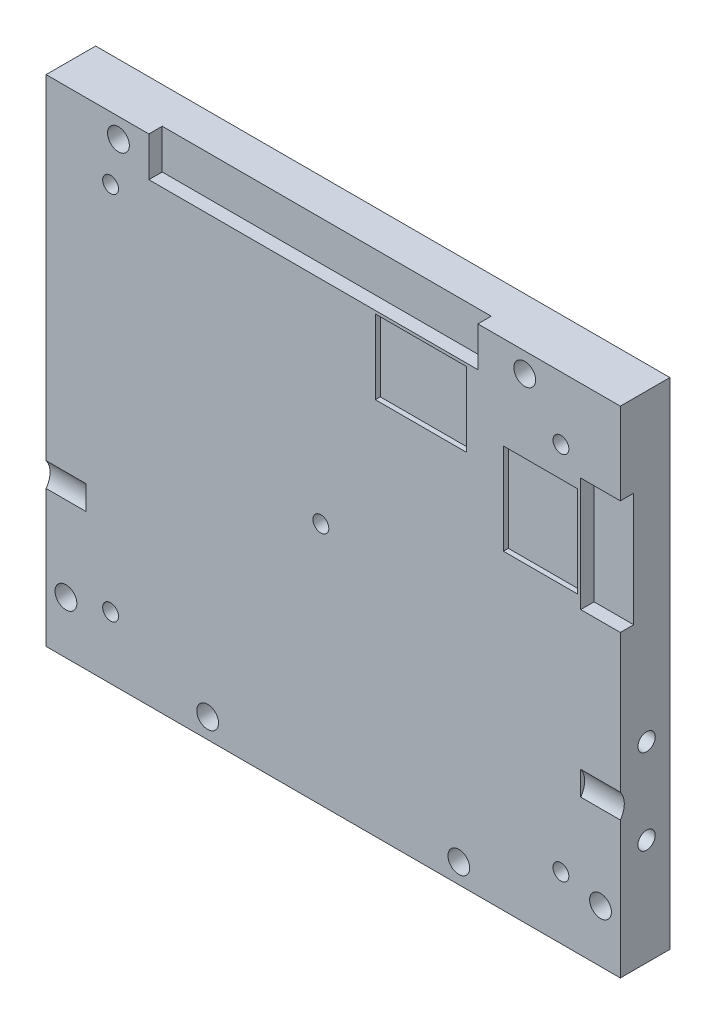
from build123d import *

# Parameters (mm, degrees)
MAIN_STOCK_START                 = -2.751909566
SKETCH_1_W                       = 57.95
SKETCH_1_H                       = 49.98
MAIN_STOCK_DEPTH                 = 5
SKETCH_2_R                       = 1.1
FRAME_6XD2P2_THROUGH_DEPTH       = 71.63982517
SKETCH_3_R                       = 0.8
PCB_5XD1P6_M2_THROUGH_DEPTH      = 71.63982517
SKETCH_4_R                       = 2.05
SMA_L_CENTER_MATCHING_ARC_DEPTH  = 4
SKETCH_5_R                       = 0.875
SMA_L_LOWER_2XD1P75_BLIND4_DEPTH = 4
SMA_R_CENTER_MATCHING_ARC_START  = -4
SKETCH_6_R                       = 2.05
SMA_R_CENTER_MATCHING_ARC_DEPTH  = 4
SMA_R_LOWER_2XD1P75_BLIND4_START = -4
SKETCH_7_R                       = 0.875
SMA_R_LOWER_2XD1P75_BLIND4_DEPTH = 4
SKETCH_8_W                       = 6.7
SKETCH_8_H                       = 11.5
RIGHT_TYPEC_WINDOW_LOWER_DEPTH   = 4
SKETCH_9_W                       = 33.203
SKETCH_9_H                       = 6.7
REAR_WINDOW_LOWER_DEPTH          = 4
SKETCH_10_W                      = 7.5
SKETCH_10_H                      = 9.2
TYPEC_BOTTOM_RECESS_A_DEPTH      = 0.5
SKETCH_11_W                      = 9.2
SKETCH_11_H                      = 7.5
TYPEC_BOTTOM_RECESS_B_DEPTH      = 0.5


with BuildPart() as part:
    # 草图1 → Main_Stock (new body)
    with BuildSketch(Plane.XY.offset(MAIN_STOCK_START)):
        with Locations((24.675, 20.69)):
            Rectangle(SKETCH_1_W, SKETCH_1_H)
    extrude(amount=MAIN_STOCK_DEPTH)

    # 草图2 → Frame_6xD2p2_Through (cut, through all)
    with BuildSketch(Plane.XY.offset(2.248090434)):
        with Locations((-2.3, 1)):
            Circle(SKETCH_2_R)
        with Locations((51.65, 1)):
            Circle(SKETCH_2_R)
        with Locations((12, -2.3)):
            Circle(SKETCH_2_R)
        with Locations((37.35, -2.3)):
            Circle(SKETCH_2_R)
        with Locations((3, 43.68)):
            Circle(SKETCH_2_R)
        with Locations((44, 43.68)):
            Circle(SKETCH_2_R)
    extrude(amount=-FRAME_6XD2P2_THROUGH_DEPTH, mode=Mode.SUBTRACT)

    # 草图3 → PCB_5xD1p6_M2_Through (cut, through all)
    with BuildSketch(Plane.XY.offset(2.248090434)):
        with Locations((23.428293927, 20.276755792)):
            Circle(SKETCH_3_R)
        with Locations((2.206251763, 39.333791606)):
            Circle(SKETCH_3_R)
        with Locations((47.653340917, 39.333791606)):
            Circle(SKETCH_3_R)
        with Locations((47.653340917, 1.976720232)):
            Circle(SKETCH_3_R)
        with Locations((2.206251763, 1.976720232)):
            Circle(SKETCH_3_R)
    extrude(amount=-PCB_5XD1P6_M2_THROUGH_DEPTH, mode=Mode.SUBTRACT)

    # 草图4 → SMA_L_Center_Matching_Arc (cut)
    with BuildSketch(Plane.ZY.offset(4.3)):
        with Locations((3.899496327, 10.725)):
            Circle(SKETCH_4_R)
    extrude(amount=-SMA_L_CENTER_MATCHING_ARC_DEPTH, mode=Mode.SUBTRACT)

    # 草图5 → SMA_L_Lower_2xD1p75_Blind4 (cut)
    with BuildSketch(Plane.ZY.offset(4.3)):
        with Locations((-0.400503673, 6.425)):
            Circle(SKETCH_5_R)
        with Locations((-0.400503673, 15.025)):
            Circle(SKETCH_5_R)
    extrude(amount=-SMA_L_LOWER_2XD1P75_BLIND4_DEPTH, mode=Mode.SUBTRACT)

    # 草图6 → SMA_R_Center_Matching_Arc (cut)
    with BuildSketch(Plane(origin=(53.65, 0, 0), x_dir=(0, 0, -1), z_dir=(1, 0, 0)).offset(SMA_R_CENTER_MATCHING_ARC_START)):
        with Locations((-3.899496327, 10.725)):
            Circle(SKETCH_6_R)
    extrude(amount=SMA_R_CENTER_MATCHING_ARC_DEPTH, mode=Mode.SUBTRACT)

    # 草图7 → SMA_R_Lower_2xD1p75_Blind4 (cut)
    with BuildSketch(Plane(origin=(53.65, 0, 0), x_dir=(0, 0, -1), z_dir=(1, 0, 0)).offset(SMA_R_LOWER_2XD1P75_BLIND4_START)):
        with Locations(Location((0.400503673, 6.425, 0), (0, 0, 180))):
            Circle(SKETCH_7_R)
        with Locations(Location((0.400503673, 15.025, 0), (0, 0, 180))):
            Circle(SKETCH_7_R)
    extrude(amount=SMA_R_LOWER_2XD1P75_BLIND4_DEPTH, mode=Mode.SUBTRACT)

    # 草图8 → Right_TypeC_Window_Lower (cut)
    with BuildSketch(Plane(origin=(53.65, 0, 0), x_dir=(0, 0, -1), z_dir=(1, 0, 0))):
        with Locations((-4.25, 31.65)):
            Rectangle(SKETCH_8_W, SKETCH_8_H)
    extrude(amount=-RIGHT_TYPEC_WINDOW_LOWER_DEPTH, mode=Mode.SUBTRACT)

    # 草图9 → Rear_Window_Lower (cut)
    with BuildSketch(Plane(origin=(0, 45.68, 0), x_dir=(1, 0, 0), z_dir=(0, 1, 0))):
        with Locations((22.6715, -4.25)):
            Rectangle(SKETCH_9_W, SKETCH_9_H)
    extrude(amount=-REAR_WINDOW_LOWER_DEPTH, mode=Mode.SUBTRACT)

    # 草图10 → TypeC_Bottom_Recess_A (cut)
    with BuildSketch(Plane.XY.offset(2.248090434)):
        with Locations((45.6, 31.7)):
            Rectangle(SKETCH_10_W, SKETCH_10_H)
    extrude(amount=-TYPEC_BOTTOM_RECESS_A_DEPTH, mode=Mode.SUBTRACT)

    # 草图11 → TypeC_Bottom_Recess_B (cut)
    with BuildSketch(Plane.XY.offset(2.248090434)):
        with Locations((33.523, 37.63)):
            Rectangle(SKETCH_11_W, SKETCH_11_H)
    extrude(amount=-TYPEC_BOTTOM_RECESS_B_DEPTH, mode=Mode.SUBTRACT)


solid = part.part
